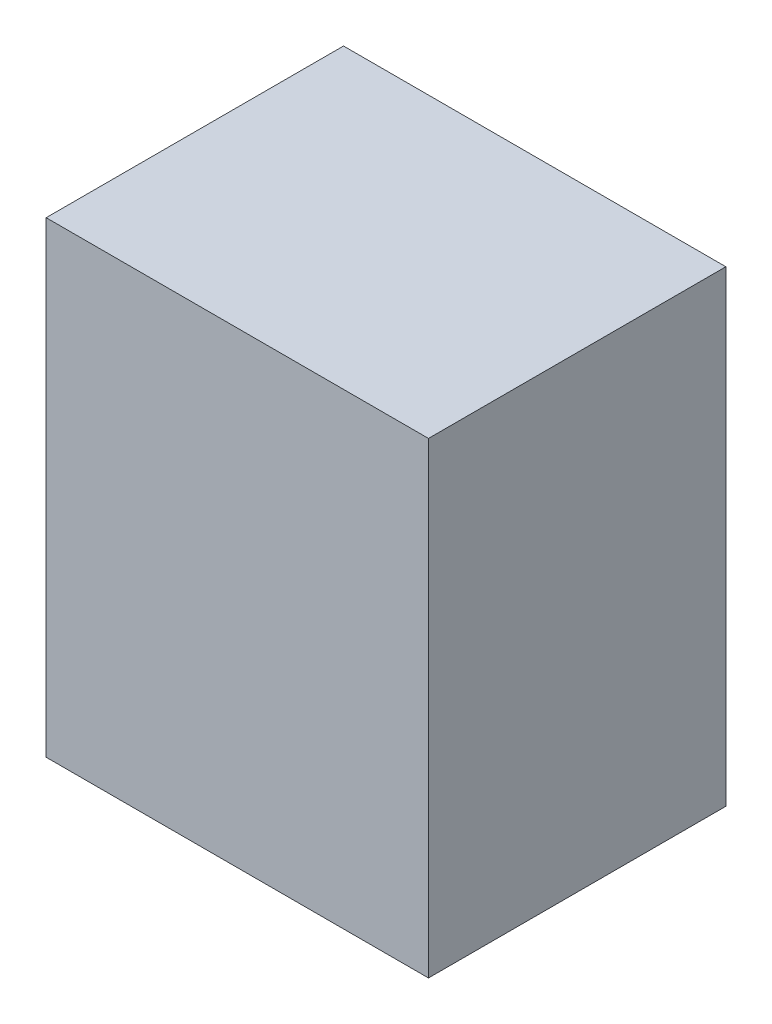
from build123d import *

# Parameters (mm, degrees)
SKETCH1_W           = 4.5
SKETCH1_H           = 5.5
BOSS_EXTRUDE1_DEPTH = 3.5


with BuildPart() as part:
    # Sketch1 → Boss-Extrude1 (new body)
    with BuildSketch(Plane.XY):
        with Locations((2.25, 2.75)):
            Rectangle(SKETCH1_W, SKETCH1_H)
    extrude(amount=BOSS_EXTRUDE1_DEPTH)


solid = part.part
